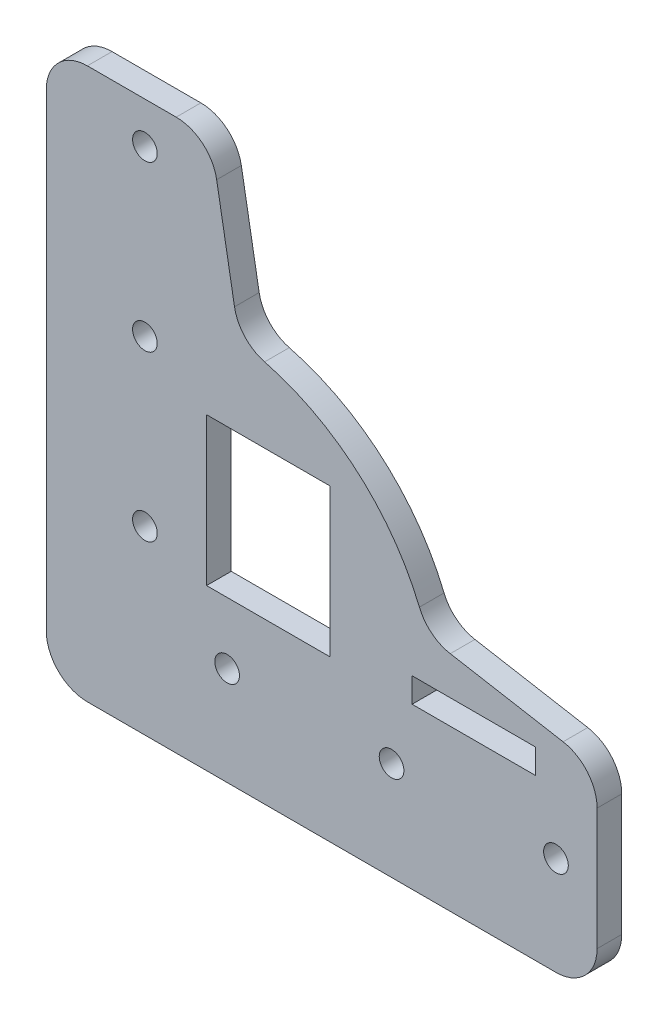
from build123d import *

# Parameters (mm, degrees)
SKETCH_1_R      = 1.5
SKETCH_1_W      = 15
SKETCH_1_H      = 18
SKETCH_1_H_2    = 3
EXTRUDE_1_DEPTH = 3
FILLET_1_R      = 5


with BuildPart() as part:
    # 草图1 → 凸台-拉伸1 (new body)
    with BuildSketch(Plane.XY):
        with BuildLine():
            Line((0, 0), (0, 67))
            Line((0, 67), (20, 67))
            Line((20, 67), (22.897896607, 50.56521166))
            ThreePointArc((22.897896607, 50.56521166), (24.147168803, 48.042864005), (26.561036073, 46.595050647))
            ThreePointArc((26.561036073, 46.595050647), (37.908605389, 40.597944156), (45.388192925, 30.167777045))
            ThreePointArc((45.388192925, 30.167777045), (46.877900379, 28.176180142), (49.14284363, 27.148698467))
            Line((49.14284363, 27.148698467), (67, 24))
            Line((67, 24), (67, 0))
            Line((67, 0), (0, 0))
        make_face()
        with Locations((12, 62)):
            Circle(SKETCH_1_R, mode=Mode.SUBTRACT)
        with Locations((12, 42)):
            Circle(SKETCH_1_R, mode=Mode.SUBTRACT)
        with Locations((12, 22)):
            Circle(SKETCH_1_R, mode=Mode.SUBTRACT)
        with Locations(Location((62, 12, 0), (0, 0, 180))):
            Circle(SKETCH_1_R, mode=Mode.SUBTRACT)
        with Locations(Location((42, 12, 0), (0, 0, 180))):
            Circle(SKETCH_1_R, mode=Mode.SUBTRACT)
        with Locations(Location((22, 12, 0), (0, 0, 180))):
            Circle(SKETCH_1_R, mode=Mode.SUBTRACT)
        with Locations((27, 28.5)):
            Rectangle(SKETCH_1_W, SKETCH_1_H, mode=Mode.SUBTRACT)
        with Locations((52, 21)):
            Rectangle(SKETCH_1_W, SKETCH_1_H_2, mode=Mode.SUBTRACT)
    extrude(amount=EXTRUDE_1_DEPTH)

    # 圆角1
    fillet_1_edges = [part.edges().sort_by_distance(p)[0] for p in [
        (0, 0, 1.5),
        (0, 67, 1.5),
        (20, 67, 1.5),
        (67, 24, 1.5),
        (67, 0, 1.5),
    ]]
    fillet(fillet_1_edges, radius=FILLET_1_R)


solid = part.part
